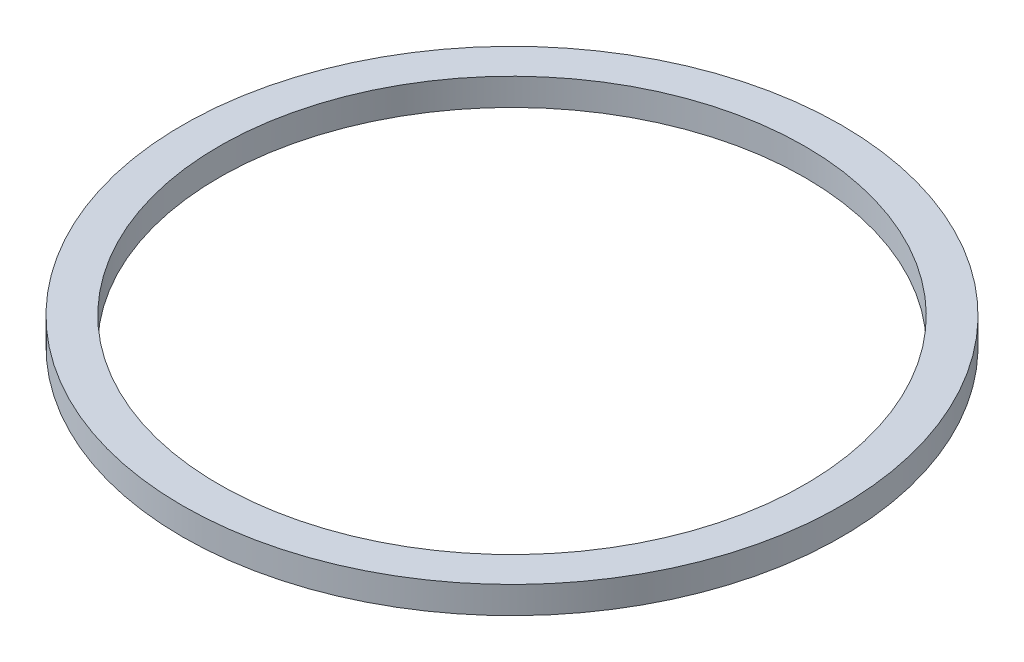
from build123d import *

# Parameters (mm, degrees)
SKETCH1_W = 7.5
SKETCH1_H = 5.5375


with BuildPart() as part:
    # Sketch1 → Revolve1 (revolve)
    with BuildSketch(Plane.XY, mode=Mode.PRIVATE) as revolve1_sk:
        with Locations((-63.75, 15.73125)):
            Rectangle(SKETCH1_W, SKETCH1_H)
    revolve(revolve1_sk.sketch.rotate(Axis((0, -200069.047495165, 0), (0, 1, 0)), 270), axis=Axis((0, -200069.047495165, 0), (0, 1, 0)))


solid = part.part
